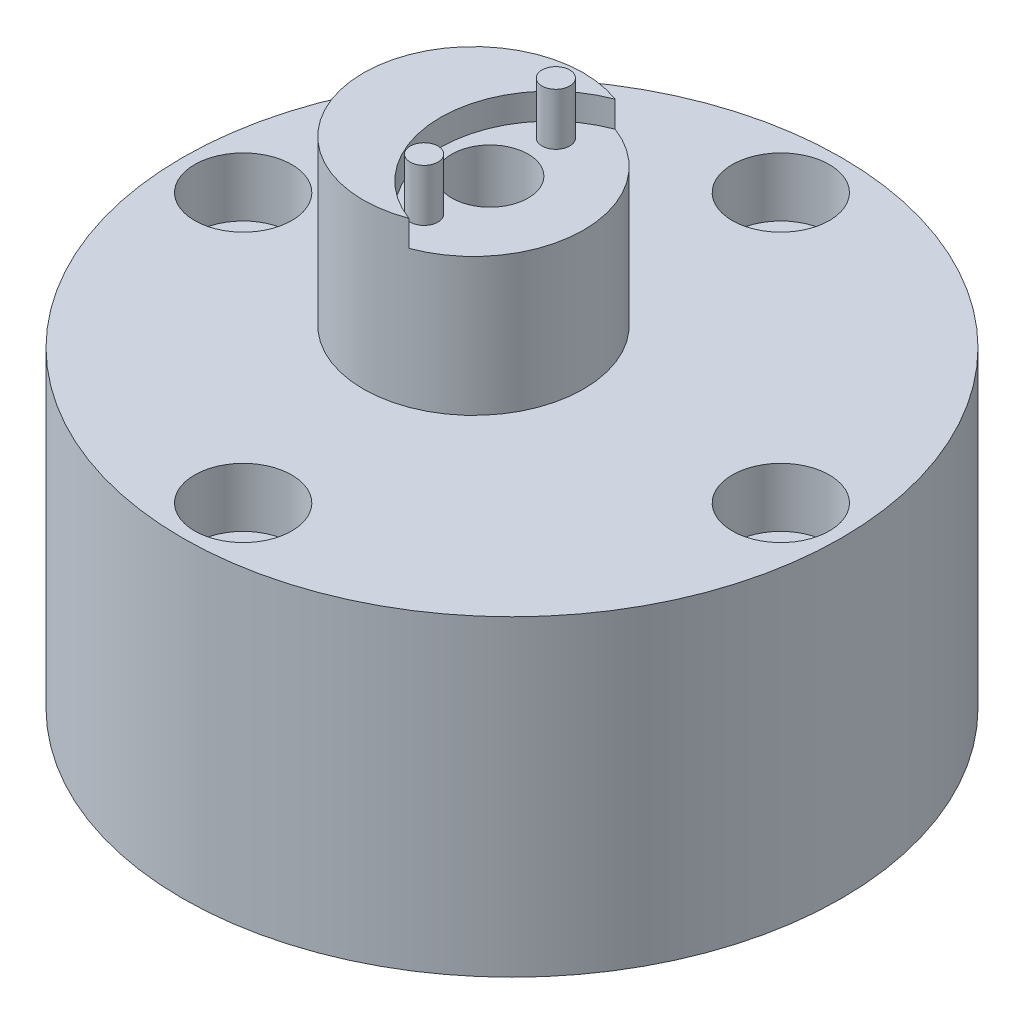
from build123d import *

# Parameters (mm, degrees)
SKETCH2_R           = 6.35
BOSS_EXTRUDE1_DEPTH = 7.9375
SKETCH7_R           = 19
BOSS_EXTRUDE5_DEPTH = 18
SKETCH8_R           = 1.7
CUT_EXTRUDE1_DEPTH  = 39.524506895
SKETCH9_R           = 2.8
CUT_EXTRUDE2_DEPTH  = 3.4
SKETCH6_R           = 2.2
CUT_EXTRUDE3_DEPTH  = 39.524506895
SKETCH10_R          = 3.9
CUT_EXTRUDE4_DEPTH  = 3
BOSS_EXTRUDE6_DEPTH = 1.5
SKETCH11_R          = 0.8
BOSS_EXTRUDE7_DEPTH = 3
SKETCH12_R          = 6
CUT_EXTRUDE5_DEPTH  = 10


with BuildPart() as part:
    # Sketch2 → Boss-Extrude1 (new body)
    with BuildSketch(Plane(origin=(0, 0, 0), x_dir=(1, 0, 0), z_dir=(0, 1, 0))):
        with Locations(Location((0, 0, 0), (0, 0, 270))):
            Circle(SKETCH2_R)
    extrude(amount=BOSS_EXTRUDE1_DEPTH)

    # Sketch7 → Boss-Extrude5 (add)
    with BuildSketch(Plane.XZ):
        with Locations(Location((2.222246, 0, 0), (0, 0, 270))):
            Circle(SKETCH7_R)
    extrude(amount=BOSS_EXTRUDE5_DEPTH)

    # Sketch8 → Cut-Extrude1 (cut, through all)
    with BuildSketch(Plane.XZ.offset(18)):
        with Locations(Location((2.222246, 15.5, 0), (0, 0, 270))):
            Circle(SKETCH8_R)
        with Locations(Location((17.722246, 0, 0), (0, 0, 270))):
            Circle(SKETCH8_R)
        with Locations(Location((2.222246, -15.5, 0), (0, 0, 270))):
            Circle(SKETCH8_R)
        with Locations(Location((-13.277754, 0, 0), (0, 0, 270))):
            Circle(SKETCH8_R)
    extrude(amount=-CUT_EXTRUDE1_DEPTH, mode=Mode.SUBTRACT)

    # Sketch9 → Cut-Extrude2 (cut)
    with BuildSketch(Plane(origin=(0, 0, 0), x_dir=(1, 0, 0), z_dir=(0, 1, 0))):
        with Locations(Location((2.222246, 15.5, 0), (0, 0, 270))):
            Circle(SKETCH9_R)
        with Locations(Location((17.722246, 0, 0), (0, 0, 270))):
            Circle(SKETCH9_R)
        with Locations(Location((2.222246, -15.5, 0), (0, 0, 270))):
            Circle(SKETCH9_R)
        with Locations(Location((-13.277754, 0, 0), (0, 0, 270))):
            Circle(SKETCH9_R)
    extrude(amount=-CUT_EXTRUDE2_DEPTH, mode=Mode.SUBTRACT)

    # Sketch6 → Cut-Extrude3 (cut, through all)
    with BuildSketch(Plane(origin=(0, 7.9375, 0), x_dir=(1, 0, 0), z_dir=(0, 1, 0))):
        with Locations(Location((0.952246, 0, 0), (0, 0, 270))):
            Circle(SKETCH6_R)
    extrude(amount=-CUT_EXTRUDE3_DEPTH, mode=Mode.SUBTRACT)

    # Sketch10 → Cut-Extrude4 (cut)
    with BuildSketch(Plane.XZ.offset(18)):
        with Locations(Location((0.952246, 0, 0), (0, 0, 270))):
            Circle(SKETCH10_R)
    extrude(amount=-CUT_EXTRUDE4_DEPTH, mode=Mode.SUBTRACT)

    # Sketch4 → Boss-Extrude6 (add)
    with BuildSketch(Plane(origin=(0, 7.9375, 0), x_dir=(1, 0, 0), z_dir=(0, 1, 0))):
        with BuildLine():
            ThreePointArc((2.221123, 5.948874904), (-1.907754, 0), (2.221123, -5.948874904))
            ThreePointArc((2.221123, -5.948874904), (-6.35, 0), (2.221123, 5.948874904))
        make_face()
    extrude(amount=BOSS_EXTRUDE6_DEPTH)

    # Sketch11 → Boss-Extrude7 (add)
    with BuildSketch(Plane(origin=(0, 7.9375, 0), x_dir=(1, 0, 0), z_dir=(0, 1, 0))):
        with Locations(Location((0.952246, 3.8, 0), (0, 0, 270))):
            Circle(SKETCH11_R)
        with Locations(Location((0.952246, -3.8, 0), (0, 0, 270))):
            Circle(SKETCH11_R)
    extrude(amount=BOSS_EXTRUDE7_DEPTH)

    # Sketch12 → Cut-Extrude5 (cut)
    with BuildSketch(Plane.XZ.offset(18)):
        with Locations(Location((2.222246, 0, 0), (0, 0, 270))):
            Circle(SKETCH12_R)
    extrude(amount=-CUT_EXTRUDE5_DEPTH, mode=Mode.SUBTRACT)


solid = part.part
